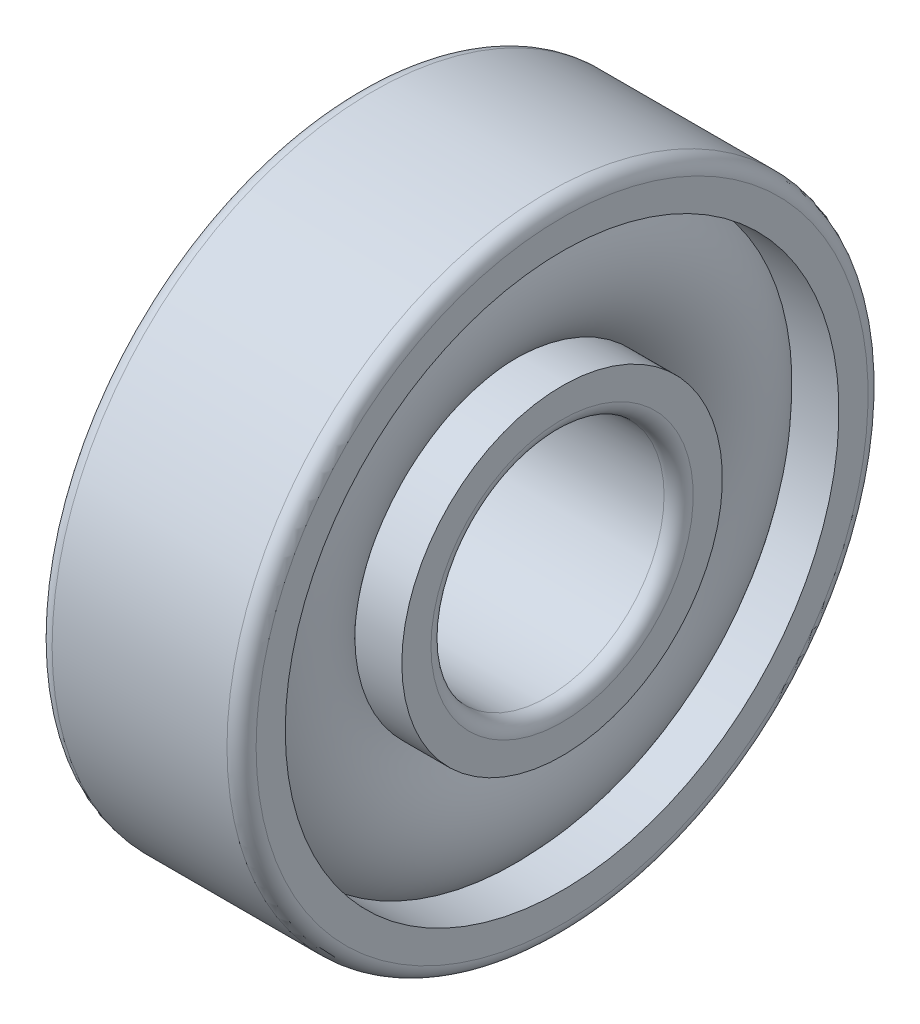
from build123d import *

# Parameters (mm, degrees)
FILETE1_R = 0.5


with BuildPart() as part:
    # Esboço1 → Revolução1 (revolve)
    with BuildSketch(Plane.XY, mode=Mode.PRIVATE) as revolu_o1_sk:
        with BuildLine():
            Line((-3.5, 11), (-3.5, 9.5))
            Line((-3.5, 9.5), (-1.887458609, 9.5))
            ThreePointArc((-1.887458609, 9.5), (0, 10.25), (1.887458609, 9.5))
            Line((1.887458609, 9.5), (3.5, 9.5))
            Line((3.5, 9.5), (3.5, 11))
            Line((3.5, 11), (-3.5, 11))
        make_face()
        with BuildLine():
            ThreePointArc((1.887458609, 9.5), (0, 10.25), (-1.887458609, 9.5))
            Line((-1.887458609, 9.5), (1.887458609, 9.5))
        make_face()
        with BuildLine():
            Line((1.887458609, 9.5), (-1.887458609, 9.5))
            ThreePointArc((-1.887458609, 9.5), (-2.75, 7.5), (-1.887458609, 5.5))
            Line((-1.887458609, 5.5), (1.887458609, 5.5))
            ThreePointArc((1.887458609, 5.5), (2.525174368, 6.410966294), (2.75, 7.5))
            ThreePointArc((2.75, 7.5), (2.525174368, 8.589033706), (1.887458609, 9.5))
        make_face()
        with BuildLine():
            Line((1.887458609, 5.5), (-1.887458609, 5.5))
            ThreePointArc((-1.887458609, 5.5), (0, 4.75), (1.887458609, 5.5))
        make_face()
        with BuildLine():
            Line((-1.887458609, 5.5), (-3.5, 5.5))
            Line((-3.5, 5.5), (-3.5, 4))
            Line((-3.5, 4), (3.5, 4))
            Line((3.5, 4), (3.5, 5.5))
            Line((3.5, 5.5), (1.887458609, 5.5))
            ThreePointArc((1.887458609, 5.5), (0, 4.75), (-1.887458609, 5.5))
        make_face()
    revolve(revolu_o1_sk.sketch.rotate(Axis((0, 0, 0), (1, 0, 0)), 90), axis=Axis((0, 0, 0), (1, 0, 0)))

    # Filete1
    filete1_edges = [part.edges().sort_by_distance(p)[0] for p in [
        (-3.5, 0, -11),
        (3.5, 0, -11),
        (3.5, 0, -4),
        (-3.5, 0, -4),
    ]]
    fillet(filete1_edges, radius=FILETE1_R)


solid = part.part
